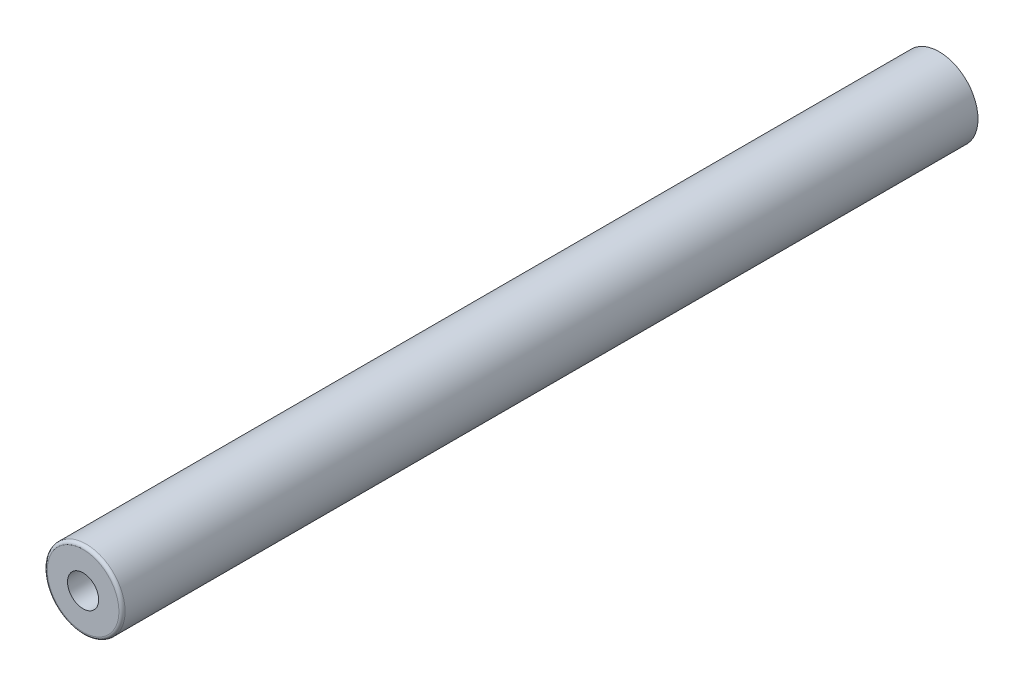
from build123d import *

# Parameters (mm, degrees)
FILLET1_R = 2


with BuildPart() as part:
    # Sketch1 → Revolve1 (revolve)
    with BuildSketch(Plane.YZ, mode=Mode.PRIVATE) as revolve1_sk:
        Polygon((10, 275), (25, 275), (25, -275), (20, -275), (20, 235), (10, 235), align=None)
    revolve(revolve1_sk.sketch.rotate(Axis((0, 0, 319.317365216), (0, 0, -1)), 90), axis=Axis((0, 0, 319.317365216), (0, 0, -1)))

    # Fillet1
    fillet1_edges = [part.edges().sort_by_distance(p)[0] for p in [
        (-25, 0, 275),
    ]]
    fillet(fillet1_edges, radius=FILLET1_R)


solid = part.part
